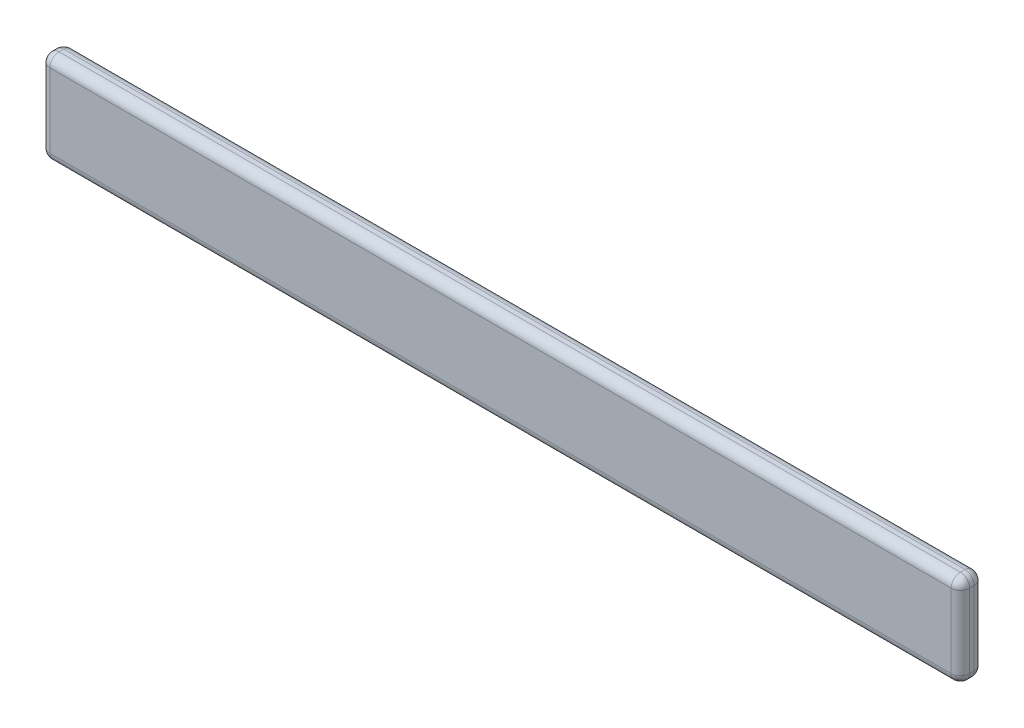
from build123d import *

# Parameters (mm, degrees)
SKETCH2_W           = 50
SKETCH2_H           = 200
BOSS_EXTRUDE1_DEPTH = 1990
FILLET1_R           = 20


with BuildPart() as part:
    # Sketch2 → Boss-Extrude1 (new body)
    with BuildSketch(Plane(origin=(0, 0, 0), x_dir=(0, 0, -1), z_dir=(1, 0, 0))):
        Rectangle(SKETCH2_W, SKETCH2_H)
    extrude(amount=BOSS_EXTRUDE1_DEPTH)

    # Fillet1
    fillet1_edges = [part.edges().sort_by_distance(p)[0] for p in [
        (1990, 0, -25),
        (1990, 100, 0),
        (1990, 0, 25),
        (0, 100, 0),
        (0, 0, -25),
        (0, -100, 0),
        (0, 0, 25),
        (1990, -100, 0),
        (995, 100, 25),
        (995, 100, -25),
        (995, -100, -25),
        (995, -100, 25),
    ]]
    fillet(fillet1_edges, radius=FILLET1_R)


solid = part.part
